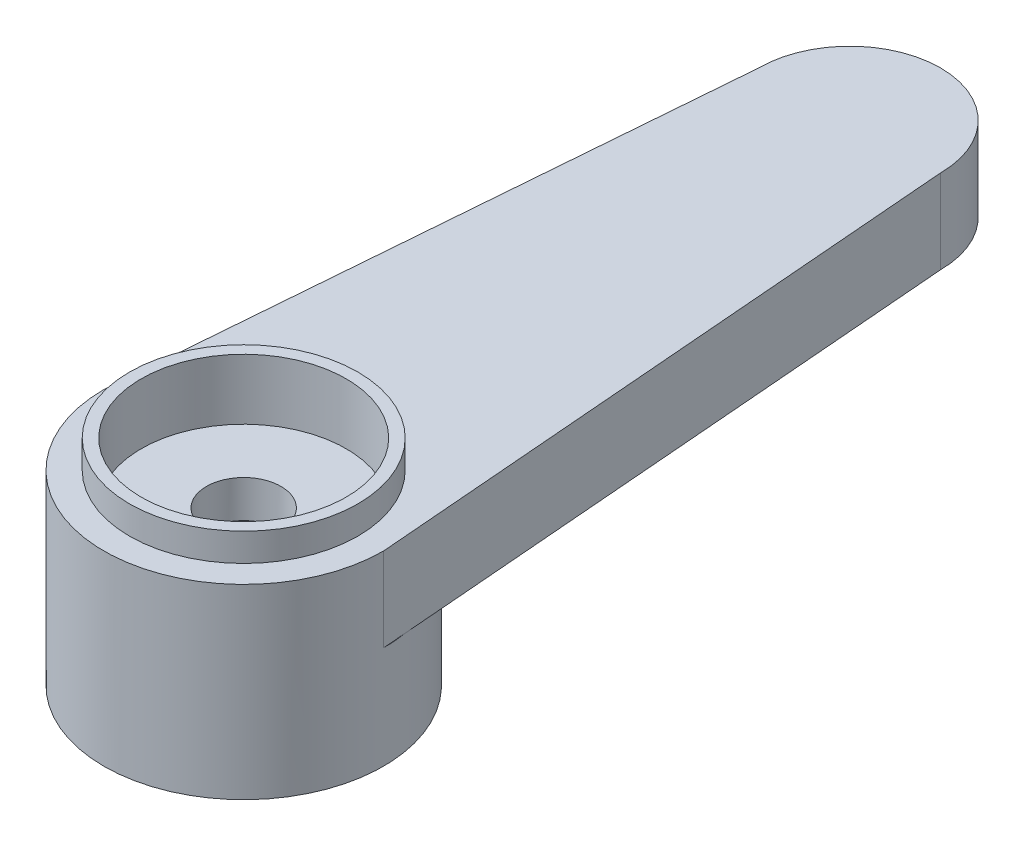
from build123d import *

# Parameters (mm, degrees)
BOSS_EXTRUDE3_DEPTH = 1.8
SKETCH3_R           = 2.45
BOSS_EXTRUDE4_DEPTH = 0.6
SKETCH4_R           = 2.2
CUT_EXTRUDE1_DEPTH  = 1.3
SKETCH5_R           = 0.8
CUT_EXTRUDE2_DEPTH  = 3
BOSS_EXTRUDE5_START = 2.2
SKETCH6_R           = 3
BOSS_EXTRUDE5_DEPTH = 2.2
SKETCH7_R           = 1.9
CUT_EXTRUDE3_DEPTH  = 2.5


with BuildPart() as part:
    # Sketch1 → Boss-Extrude3 (new body)
    with BuildSketch(Plane(origin=(0, 0, 0), x_dir=(1, 0, 0), z_dir=(0, 1, 0))):
        with BuildLine():
            Line((-3, 0), (-1.95, 13))
            ThreePointArc((-1.95, 13), (0, 14.95), (1.95, 13))
            Line((1.95, 13), (3, 0))
            ThreePointArc((3, 0), (0, -3), (-3, 0))
        make_face()
    extrude(amount=BOSS_EXTRUDE3_DEPTH)

    # Sketch3 → Boss-Extrude4 (add)
    with BuildSketch(Plane(origin=(0, 1.8, 0), x_dir=(1, 0, 0), z_dir=(0, 1, 0))):
        with Locations(Location((0, 0, 0), (0, 0, 270))):
            Circle(SKETCH3_R)
    extrude(amount=BOSS_EXTRUDE4_DEPTH)

    # Sketch4 → Cut-Extrude1 (cut)
    with BuildSketch(Plane(origin=(0, 2.4, 0), x_dir=(1, 0, 0), z_dir=(0, 1, 0))):
        with Locations(Location((0, 0, 0), (0, 0, 270))):
            Circle(SKETCH4_R)
    extrude(amount=-CUT_EXTRUDE1_DEPTH, mode=Mode.SUBTRACT)

    # Sketch5 → Cut-Extrude2 (cut)
    with BuildSketch(Plane(origin=(0, 1.1, 0), x_dir=(1, 0, 0), z_dir=(0, 1, 0))):
        with Locations(Location((0, 0, 0), (0, 0, 270))):
            Circle(SKETCH5_R)
    extrude(amount=-CUT_EXTRUDE2_DEPTH, mode=Mode.SUBTRACT)

    # Sketch6 → Boss-Extrude5 (add)
    with BuildSketch(Plane.XZ.offset(BOSS_EXTRUDE5_START)):
        with Locations(Location((0, 0, 0), (0, 0, 270))):
            Circle(SKETCH6_R)
    extrude(amount=-BOSS_EXTRUDE5_DEPTH)

    # Sketch7 → Cut-Extrude3 (cut)
    with BuildSketch(Plane.XZ.offset(2.2)):
        with Locations(Location((0, 0, 0), (0, 0, 270))):
            Circle(SKETCH7_R)
    extrude(amount=-CUT_EXTRUDE3_DEPTH, mode=Mode.SUBTRACT)


solid = part.part
